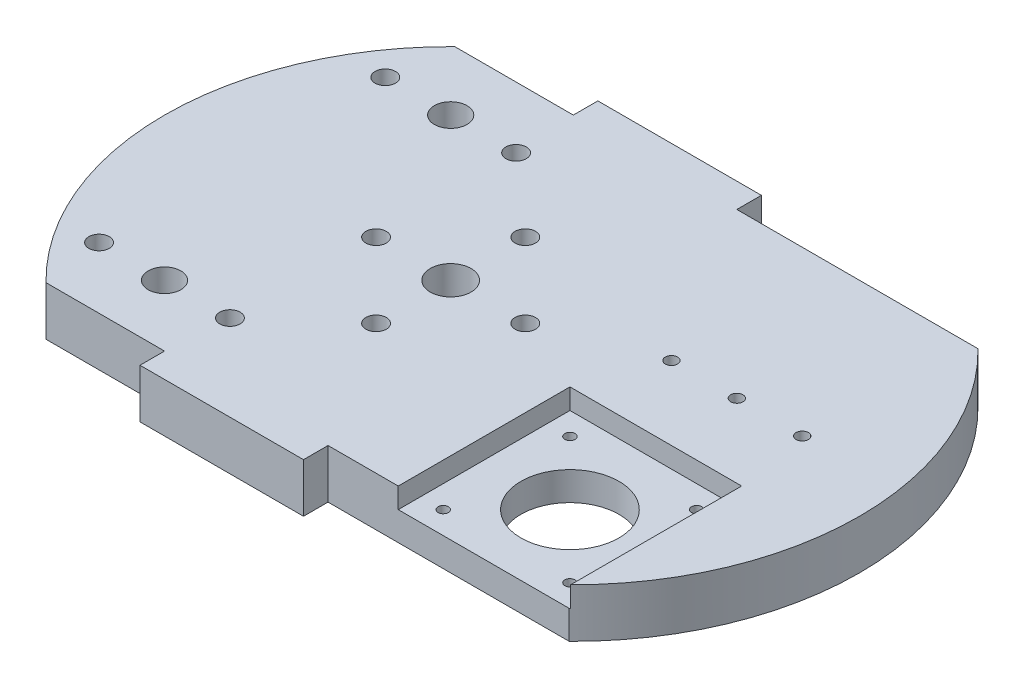
from build123d import *

# Parameters (mm, degrees)
SKETCH1_W           = 150
SKETCH1_H           = 150
BOSS_EXTRUDE1_DEPTH = 12
SKETCH8_W           = 200
SKETCH8_H           = 200
CUT_EXTRUDE7_DEPTH  = 15
BOSS_EXTRUDE2_DEPTH = 12
SKETCH6_W           = 42
SKETCH6_H           = 42
CUT_EXTRUDE5_DEPTH  = 5
SKETCH9_R           = 4
SKETCH9_R_2         = 2.5
CUT_EXTRUDE8_DEPTH  = 15
SKETCH10_R          = 12
SKETCH10_R_2        = 1.25
CUT_EXTRUDE9_DEPTH  = 10
SKETCH12_R          = 2.5
SKETCH12_R_2        = 5
SKETCH12_R_3        = 1.5
CUT_EXTRUDE10_DEPTH = 20
SKETCH16_R          = 26
CUT_EXTRUDE11_DEPTH = 3
SKETCH17_R          = 5
CUT_EXTRUDE12_DEPTH = 3


with BuildPart() as part:
    # Sketch1 → Boss-Extrude1 (new body)
    with BuildSketch(Plane(origin=(0, 0, 0), x_dir=(1, 0, 0), z_dir=(0, 1, 0))):
        Rectangle(SKETCH1_W, SKETCH1_H)
    extrude(amount=BOSS_EXTRUDE1_DEPTH)

    # Sketch8 → Cut-Extrude7 (cut)
    with BuildSketch(Plane(origin=(0, 12, 0), x_dir=(1, 0, 0), z_dir=(0, 1, 0))):
        Rectangle(SKETCH8_W, SKETCH8_H)
        with BuildLine():
            Line((-48.989794856, 50), (-20, 50))
            Line((-20, 50), (-20, 56))
            Line((-20, 56), (20, 56))
            Line((20, 56), (20, 50))
            Line((20, 50), (48.989794856, 50))
            ThreePointArc((48.989794856, 50), (70, 0), (48.989794856, -50))
            Line((48.989794856, -50), (20, -50))
            Line((20, -50), (20, -56))
            Line((20, -56), (-20, -56))
            Line((-20, -56), (-20, -50))
            Line((-20, -50), (-48.989794856, -50))
            ThreePointArc((-48.989794856, -50), (-70, 0), (-48.989794856, 50))
        make_face(mode=Mode.SUBTRACT)
    extrude(amount=-CUT_EXTRUDE7_DEPTH, mode=Mode.SUBTRACT)

    # Sketch11 → Boss-Extrude2 (add)
    with BuildSketch(Plane(origin=(0, 12, 0), x_dir=(1, 0, 0), z_dir=(0, 1, 0))):
        with BuildLine():
            Line((48.989794856, 50), (78.989794856, 50))
            ThreePointArc((78.989794856, 50), (100, 0), (78.989794856, -50))
            Line((78.989794856, -50), (48.989794856, -50))
            ThreePointArc((48.989794856, -50), (70, 0), (48.989794856, 50))
        make_face()
    extrude(amount=-BOSS_EXTRUDE2_DEPTH)

    # Sketch6 → Cut-Extrude5 (cut)
    with BuildSketch(Plane(origin=(0, 12, 0), x_dir=(1, 0, 0), z_dir=(0, 1, 0))):
        with Locations((58.172158289, -29)):
            Rectangle(SKETCH6_W, SKETCH6_H)
    extrude(amount=-CUT_EXTRUDE5_DEPTH, mode=Mode.SUBTRACT)

    # Sketch9 → Cut-Extrude8 (cut)
    with BuildSketch(Plane(origin=(0, 12, 0), x_dir=(1, 0, 0), z_dir=(0, 1, 0))):
        with Locations(Location((-35, 35, 0), (0, 0, 270))):
            Circle(SKETCH9_R)
        with Locations(Location((-35, -35, 0), (0, 0, 270))):
            Circle(SKETCH9_R)
        with Locations(Location((-19, 35, 0), (0, 0, 270))):
            Circle(SKETCH9_R_2)
        with Locations(Location((-51, 35, 0), (0, 0, 270))):
            Circle(SKETCH9_R_2)
        with Locations(Location((-19, -35, 0), (0, 0, 270))):
            Circle(SKETCH9_R_2)
        with Locations(Location((-51, -35, 0), (0, 0, 270))):
            Circle(SKETCH9_R_2)
    extrude(amount=-CUT_EXTRUDE8_DEPTH, mode=Mode.SUBTRACT)

    # Sketch10 → Cut-Extrude9 (cut)
    with BuildSketch(Plane(origin=(0, 7, 0), x_dir=(1, 0, 0), z_dir=(0, 1, 0))):
        with Locations(Location((58.172158289, -29, 0), (0, 0, 270))):
            Circle(SKETCH10_R)
        with Locations(Location((42.672158289, -13.5, 0), (0, 0, 270))):
            Circle(SKETCH10_R_2)
        with Locations(Location((73.672158289, -13.5, 0), (0, 0, 270))):
            Circle(SKETCH10_R_2)
        with Locations(Location((42.672158289, -44.5, 0), (0, 0, 270))):
            Circle(SKETCH10_R_2)
        with Locations(Location((73.672158289, -44.5, 0), (0, 0, 270))):
            Circle(SKETCH10_R_2)
    extrude(amount=-CUT_EXTRUDE9_DEPTH, mode=Mode.SUBTRACT)

    # Sketch12 → Cut-Extrude10 (cut)
    with BuildSketch(Plane(origin=(0, 12, 0), x_dir=(1, 0, 0), z_dir=(0, 1, 0))):
        with Locations(Location((0, 18.25, 0), (0, 0, 270))):
            Circle(SKETCH12_R)
        with Locations(Location((0, -18.25, 0), (0, 0, 270))):
            Circle(SKETCH12_R)
        with Locations(Location((0, 0, 0), (0, 0, 270))):
            Circle(SKETCH12_R_2)
        with Locations(Location((18.25, 0, 0), (0, 0, 270))):
            Circle(SKETCH12_R)
        with Locations(Location((-18.25, 0, 0), (0, 0, 270))):
            Circle(SKETCH12_R)
        with Locations(Location((76, 10, 0), (0, 0, 270))):
            Circle(SKETCH12_R_3)
        with Locations(Location((60, 10, 0), (0, 0, 270))):
            Circle(SKETCH12_R_3)
        with Locations(Location((44, 10, 0), (0, 0, 270))):
            Circle(SKETCH12_R_3)
    extrude(amount=-CUT_EXTRUDE10_DEPTH, mode=Mode.SUBTRACT)

    # Sketch16 → Cut-Extrude11 (cut)
    with BuildSketch(Plane.XZ):
        with Locations(Location((0, 0, 0), (0, 0, 270))):
            Circle(SKETCH16_R)
    extrude(amount=-CUT_EXTRUDE11_DEPTH, mode=Mode.SUBTRACT)

    # Sketch17 → Cut-Extrude12 (cut)
    with BuildSketch(Plane.XZ.offset(-3)):
        with Locations(Location((0, 18.25, 0), (0, 0, 270))):
            Circle(SKETCH17_R)
        with Locations(Location((0, -18.25, 0), (0, 0, 270))):
            Circle(SKETCH17_R)
    extrude(amount=-CUT_EXTRUDE12_DEPTH, mode=Mode.SUBTRACT)


solid = part.part
